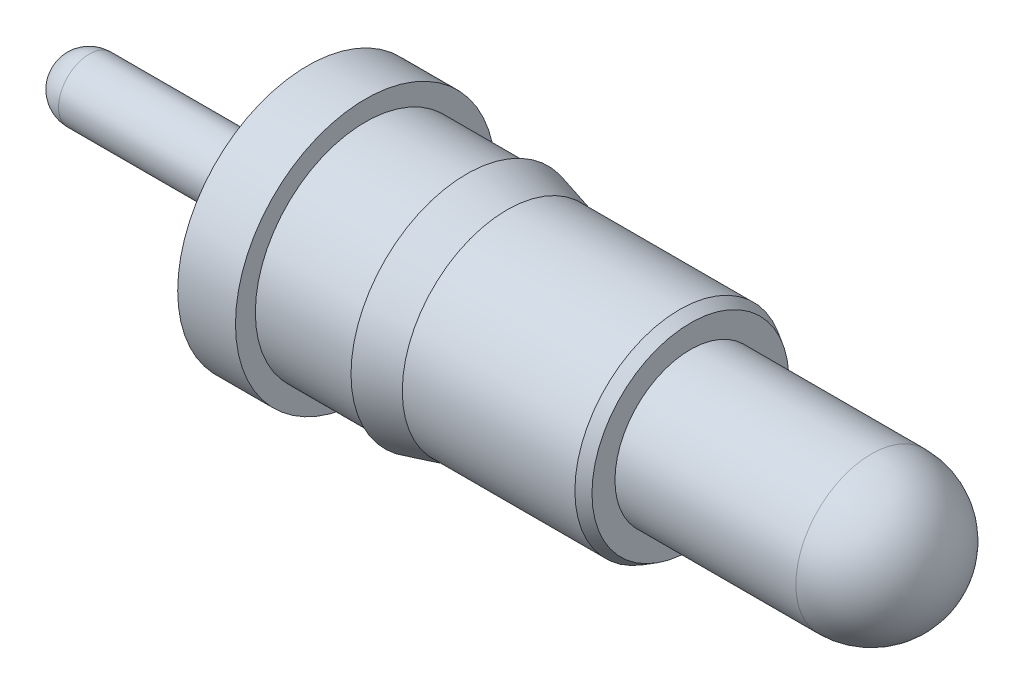
from build123d import *


with BuildPart() as part:
    # Sketch1 → Revolve1 (revolve)
    with BuildSketch(Plane.XY, mode=Mode.PRIVATE) as revolve1_sk:
        with BuildLine():
            Line((0, 0), (6.2484, 0))
            ThreePointArc((6.2484, 0), (6.092914706, 0.375374706), (5.71754, 0.53086))
            Line((5.71754, 0.53086), (4.445, 0.53086))
            Line((4.445, 0.53086), (4.445, 0.692605909))
            Line((4.445, 0.692605909), (4.3688, 0.7366))
            Line((4.3688, 0.7366), (3.154582272, 0.7366))
            Line((3.154582272, 0.7366), (2.8702, 0.8128))
            Line((2.8702, 0.8128), (2.8702, 0.7747))
            Line((2.8702, 0.7747), (2.159, 0.7747))
            Line((2.159, 0.7747), (2.159, 0.9144))
            Line((2.159, 0.9144), (1.7526, 0.9144))
            Line((1.7526, 0.9144), (1.7526, 0.2921))
            ThreePointArc((1.7526, 0.2921), (1.730281537, 0.238218463), (1.6764, 0.2159))
            Line((1.6764, 0.2159), (0.2159, 0.2159))
            ThreePointArc((0.2159, 0.2159), (0.063235646, 0.152664354), (0, 0))
        make_face()
    revolve(revolve1_sk.sketch.rotate(Axis((0, 0, 0), (1, 0, 0)), 90), axis=Axis((0, 0, 0), (1, 0, 0)))


solid = part.part
